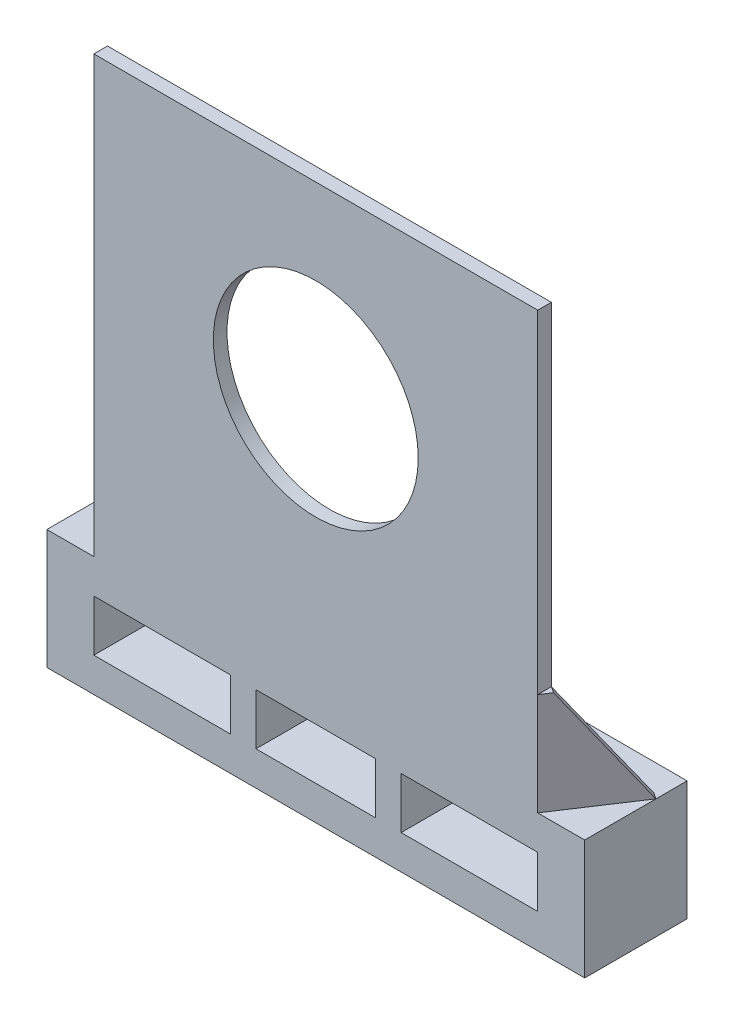
from build123d import *

# Parameters (mm, degrees)
SKETCH1_W           = 390
SKETCH1_H           = 382.5
SKETCH1_R           = 90
BOSS_EXTRUDE1_DEPTH = 12
SKETCH2_W           = 472.5
SKETCH2_H           = 105
SKETCH2_W_2         = 120
SKETCH2_H_2         = 45
SKETCH2_W_3         = 105
BOSS_EXTRUDE2_DEPTH = 90
BOSS_EXTRUDE3_DEPTH = 90
CUT_EXTRUDE1_DEPTH  = 90


with BuildPart() as part:
    # Sketch1 → Boss-Extrude1 (new body)
    with BuildSketch(Plane.XY):
        Rectangle(SKETCH1_W, SKETCH1_H)
        with Locations((0, 26.25)):
            Circle(SKETCH1_R, mode=Mode.SUBTRACT)
    extrude(amount=BOSS_EXTRUDE1_DEPTH)

    # Sketch2 → Boss-Extrude2 (add)
    with BuildSketch(Plane.XY.offset(12)):
        with Locations((0, -243.75)):
            Rectangle(SKETCH2_W, SKETCH2_H)
        with Locations((135, -243.75)):
            Rectangle(SKETCH2_W_2, SKETCH2_H_2, mode=Mode.SUBTRACT)
        with Locations((0, -243.75)):
            Rectangle(SKETCH2_W_3, SKETCH2_H_2, mode=Mode.SUBTRACT)
        with Locations((-135, -243.75)):
            Rectangle(SKETCH2_W_2, SKETCH2_H_2, mode=Mode.SUBTRACT)
    extrude(amount=-BOSS_EXTRUDE2_DEPTH)

    # Sketch3 → Boss-Extrude3 (add)
    with BuildSketch(Plane(origin=(0, -191.25, 0), x_dir=(1, 0, 0), z_dir=(0, 1, 0))):
        Polygon((195, -12), (236.25, 50.637349082), (230.737913281, 54.267349082), (195, 0), align=None)
    boss_extrude3 = extrude(amount=BOSS_EXTRUDE3_DEPTH)

    # Sketch4 → Cut-Extrude1 (cut)
    with BuildSketch(Plane(origin=(141.524586719, 0, 93.201409187), x_dir=(0.5500000000000003, 0, -0.8351646544245032), z_dir=(0.8351646544245033, 0, 0.5500000000000003))):
        Polygon((172.228024147, -101.25), (107.25, -101.25), (172.228024147, -191.25), align=None)
    cut_extrude1 = extrude(amount=-CUT_EXTRUDE1_DEPTH, mode=Mode.SUBTRACT)

    # Mirror1: Boss-Extrude3, Cut-Extrude1 across plane
    add(boss_extrude3.mirror(Plane(origin=(0, 0, 0), x_dir=(0, 0, 1), z_dir=(1, 0, 0))))
    add(cut_extrude1.mirror(Plane(origin=(0, 0, 0), x_dir=(0, 0, 1), z_dir=(1, 0, 0))), mode=Mode.SUBTRACT)


solid = part.part
